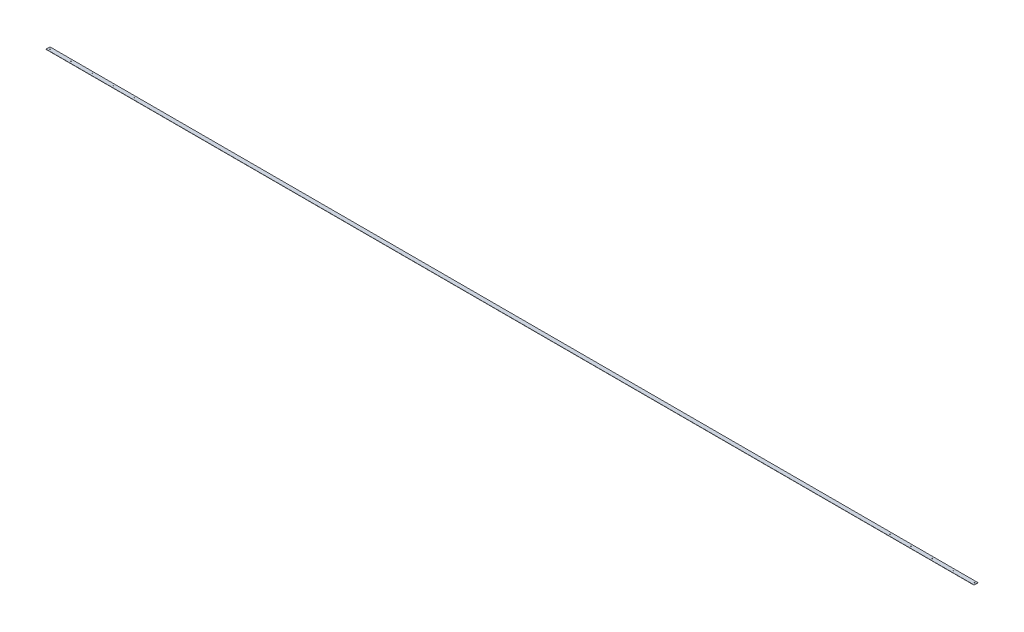
from build123d import *

# Parameters (mm, degrees)
SKETCH1_W           = 9358.5
SKETCH1_H           = 40
BOSS_EXTRUDE1_DEPTH = 2
SKETCH2_R           = 3.4
CUT_EXTRUDE1_DEPTH  = 10


with BuildPart() as part:
    # Sketch1 → Boss-Extrude1 (new body)
    with BuildSketch(Plane(origin=(0, 0, 0), x_dir=(1, 0, 0), z_dir=(0, 1, 0))):
        Rectangle(SKETCH1_W, SKETCH1_H)
    extrude(amount=BOSS_EXTRUDE1_DEPTH)

    # Sketch2 → Cut-Extrude1 (cut)
    with BuildSketch(Plane(origin=(0, 2, 0), x_dir=(1, 0, 0), z_dir=(0, 1, 0))):
        with Locations(Location((-4659.25, 0, 0), (0, 0, 270))):
            Circle(SKETCH2_R)
        with Locations(Location((-4446.75, 0, 0), (0, 0, 270))):
            Circle(SKETCH2_R)
        with Locations(Location((-4234.25, 0, 0), (0, 0, 270))):
            Circle(SKETCH2_R)
        with Locations(Location((-4021.75, 0, 0), (0, 0, 270))):
            Circle(SKETCH2_R)
        with Locations(Location((-3809.25, 0, 0), (0, 0, 270))):
            Circle(SKETCH2_R)
        with Locations(Location((4662.25, 0, 0), (0, 0, 270))):
            Circle(SKETCH2_R)
        with Locations(Location((4449.75, 0, 0), (0, 0, 270))):
            Circle(SKETCH2_R)
        with Locations(Location((4237.25, 0, 0), (0, 0, 270))):
            Circle(SKETCH2_R)
        with Locations(Location((4024.75, 0, 0), (0, 0, 270))):
            Circle(SKETCH2_R)
        with Locations(Location((3812.25, 0, 0), (0, 0, 270))):
            Circle(SKETCH2_R)
    extrude(amount=-CUT_EXTRUDE1_DEPTH, mode=Mode.SUBTRACT)


solid = part.part
